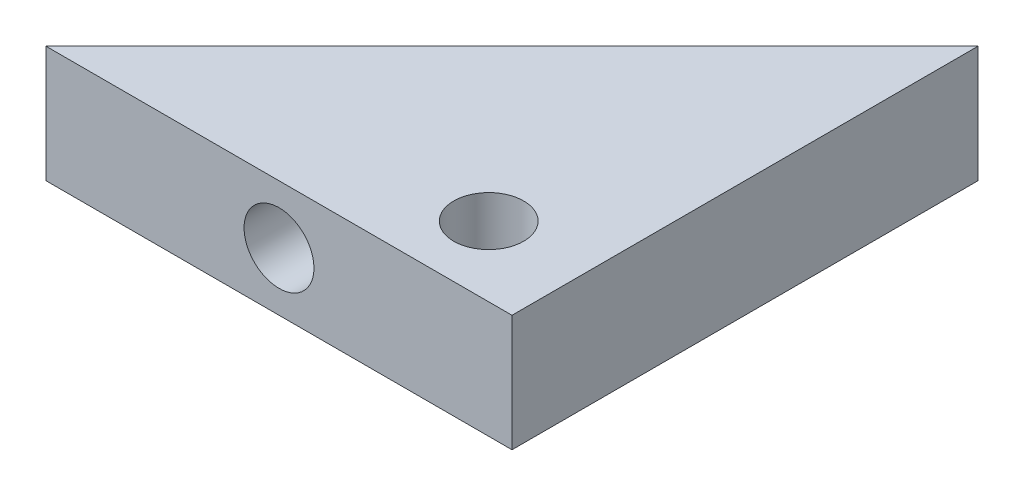
from build123d import *

# Parameters (mm, degrees)
BOSS_EXTRUDE1_DEPTH = 5
SKETCH2_R           = 1.5
CUT_EXTRUDE1_DEPTH  = 7
SKETCH3_R           = 1.5
CUT_EXTRUDE2_DEPTH  = 7
SKETCH4_R           = 1.5
CUT_EXTRUDE3_DEPTH  = 7


with BuildPart() as part:
    # Sketch1 → Boss-Extrude1 (new body)
    with BuildSketch(Plane(origin=(0, 0, 0), x_dir=(1, 0, 0), z_dir=(0, 1, 0))):
        Polygon((0, 0), (-20, 0), (0, 20), align=None)
    extrude(amount=BOSS_EXTRUDE1_DEPTH)

    # Sketch2 → Cut-Extrude1 (cut)
    with BuildSketch(Plane.XY):
        with Locations((-10, 2.5)):
            Circle(SKETCH2_R)
    extrude(amount=-CUT_EXTRUDE1_DEPTH, mode=Mode.SUBTRACT)

    # Sketch3 → Cut-Extrude2 (cut)
    with BuildSketch(Plane(origin=(-10, 0, -10), x_dir=(-0.7071067811865511, 0, 0.7071067811865439), z_dir=(-0.7071067811865439, 0, -0.7071067811865511))):
        with Locations((-3.357864376, 2.5)):
            Circle(SKETCH3_R)
    extrude(amount=-CUT_EXTRUDE2_DEPTH, mode=Mode.SUBTRACT)

    # Sketch4 → Cut-Extrude3 (cut)
    with BuildSketch(Plane(origin=(0, 5, 0), x_dir=(1, 0, 0), z_dir=(0, 1, 0))):
        with Locations(Location((-4, 3, 0), (0, 0, 270))):
            Circle(SKETCH4_R)
    extrude(amount=-CUT_EXTRUDE3_DEPTH, mode=Mode.SUBTRACT)


solid = part.part
